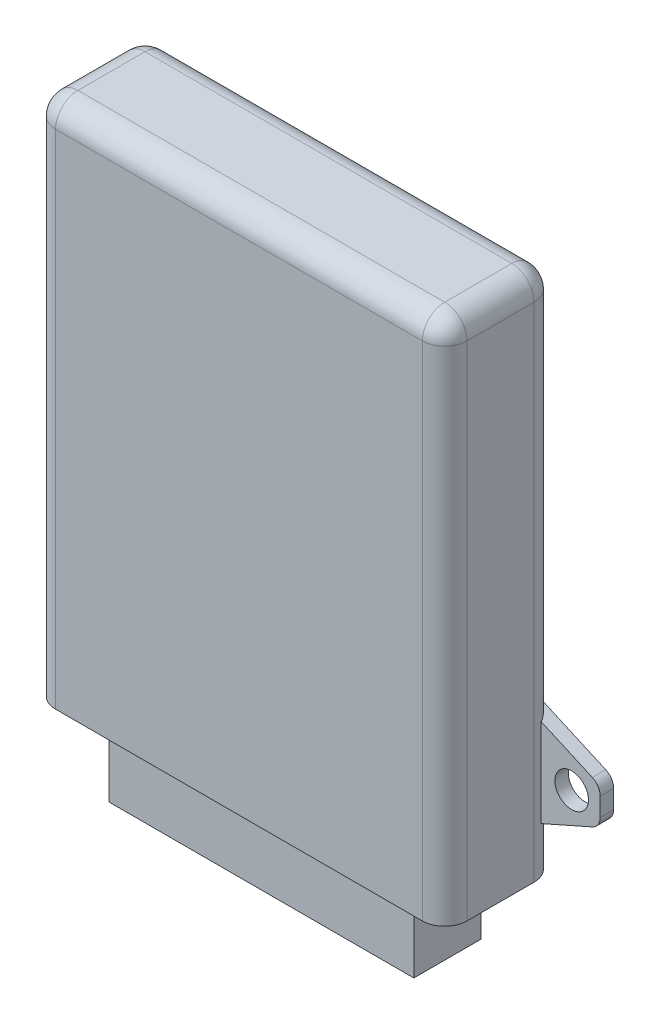
from build123d import *

# Parameters (mm, degrees)
EXTRUDE_1_DEPTH = 25
FILLET_2_R      = 5
FILLET_3_R      = 5
SKETCH_2_W      = 68.2
SKETCH_2_H      = 15
EXTRUDE_2_DEPTH = 17
SKETCH_3_R      = 3.75
EXTRUDE_3_DEPTH = 3


with BuildPart() as part:
    # 草图1 → 凸台-拉伸1 (new body)
    with BuildSketch(Plane.XY):
        with BuildLine():
            Line((-37.933333333, 65.994666667), (44.066666667, 65.994666667))
            ThreePointArc((44.066666667, 65.994666667), (47.602200573, 64.530200573), (49.066666667, 60.994666667))
            Line((49.066666667, 60.994666667), (49.066666667, -51.305333333))
            Line((49.066666667, -51.305333333), (-42.933333333, -51.305333333))
            Line((-42.933333333, -51.305333333), (-42.933333333, 60.994666667))
            ThreePointArc((-42.933333333, 60.994666667), (-41.468867239, 64.530200573), (-37.933333333, 65.994666667))
        make_face()
    extrude(amount=EXTRUDE_1_DEPTH)

    # 圆角2
    fillet_2_edges = [part.edges().sort_by_distance(p)[0] for p in [
        (47.602200573, 64.530200573, 25),
        (49.066666667, 4.844666667, 25),
        (-42.933333333, 4.844666667, 25),
        (-41.468867239, 64.530200573, 25),
        (3.066666667, 65.994666667, 25),
    ]]
    fillet(fillet_2_edges, radius=FILLET_2_R)

    # 圆角3
    fillet_3_edges = [part.edges().sort_by_distance(p)[0] for p in [
        (-42.933333333, 4.844666667, 0),
        (49.066666667, 4.844666667, 0),
        (47.602200573, 64.530200573, 0),
        (3.066666667, 65.994666667, 0),
        (-41.468867239, 64.530200573, 0),
    ]]
    fillet(fillet_3_edges, radius=FILLET_3_R)

    # 草图2 → 凸台-拉伸2 (add)
    with BuildSketch(Plane.XZ.offset(51.305333333)):
        with Locations((3.066666667, 12.5)):
            Rectangle(SKETCH_2_W, SKETCH_2_H)
    extrude(amount=EXTRUDE_2_DEPTH)

    # 草图3 → 凸台-拉伸3 (add)
    with BuildSketch(Plane(origin=(0, 0, 0), x_dir=(-1, 0, 0), z_dir=(0, 0, -1))):
        with BuildLine():
            Line((-60.065426781, -26.521117388), (-43.846003667, -19.305333333))
            Line((-43.846003667, -19.305333333), (-43.846003667, -31.305333333))
            Line((-43.846003667, -31.305333333), (-43.846003667, -43.305333333))
            Line((-43.846003667, -43.305333333), (-60.063408173, -36.104747529))
            ThreePointArc((-60.063408173, -36.104747529), (-61.361177964, -34.998068142), (-61.846002246, -33.362864452))
            Line((-61.846002246, -33.362864452), (-61.846002246, -29.262103306))
            ThreePointArc((-61.846002246, -29.262103306), (-61.36177982, -27.62782573), (-60.065426781, -26.521117388))
        make_face()
        with Locations((-55.456334457, -31.312483879)):
            Circle(SKETCH_3_R, mode=Mode.SUBTRACT)
    extrude_3 = extrude(amount=-EXTRUDE_3_DEPTH)

    # 镜向1: 凸台-拉伸3 across plane
    add(extrude_3.mirror(Plane(origin=(3.066666667, 0, 0), x_dir=(0, 0, 1), z_dir=(1, 0, 0))))


solid = part.part
